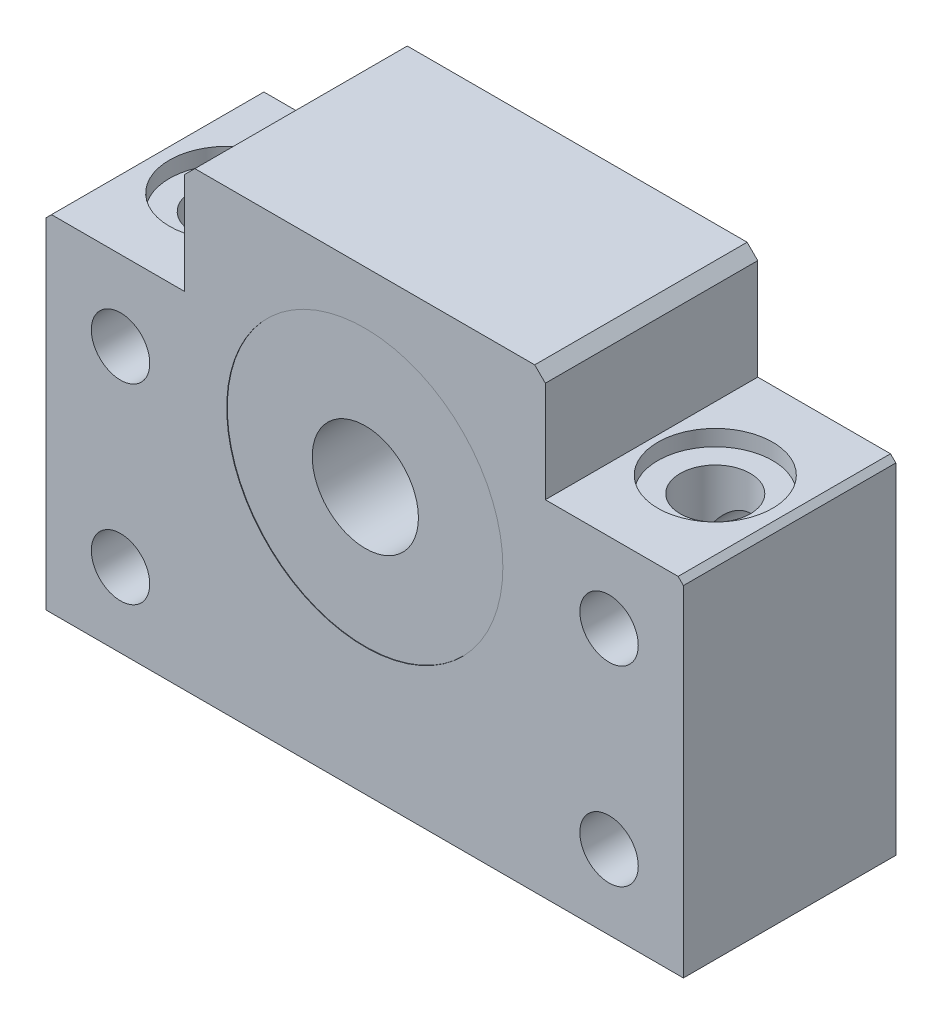
from build123d import *

# Parameters (mm, degrees)
EXTRUDE_1_DEPTH      = 10
EXTRUDE_1_DEPTH_BACK = 10
SKETCH_1_R           = 2.75
SKETCH_1_R_2         = 13
CUT_EXTRUDE_START    = 7.5
SKETCH_2_R           = 3.3
CUT_EXTRUDE_1_DEPTH  = 48.811288741
SKETCH_3_R           = 5.4
CUT_EXTRUDE_2_DEPTH  = 1.5
EXTRUDE_2_DEPTH      = 4
EXTRUDE_2_DEPTH_BACK = 4
EXTRUDE_2_START      = 5.95
SKETCH_4_R           = 13
SKETCH_4_R_2         = 5


with BuildPart() as part:
    # Эскиз1 → Бобышка-Вытянуть1 (new, two sides: drawn at the far end of the back side and taken through both)
    with BuildSketch(Plane.XY.offset(-EXTRUDE_1_DEPTH_BACK)):
        Polygon((-30, -25), (-30, 7), (-29.5, 7.5), (-17, 7.5), (-17, 17), (-16, 18), (16, 18), (17, 17), (17, 7.5), (29.5, 7.5), (30, 7), (30, -25), align=None)
        with Locations((-23, 0)):
            Circle(SKETCH_1_R, mode=Mode.SUBTRACT)
        with Locations((-23, -18)):
            Circle(SKETCH_1_R, mode=Mode.SUBTRACT)
        with Locations(Location((23, -18, 0), (0, 0, 180))):
            Circle(SKETCH_1_R, mode=Mode.SUBTRACT)
        with Locations(Location((23, 0, 0), (0, 0, 180))):
            Circle(SKETCH_1_R, mode=Mode.SUBTRACT)
        Circle(SKETCH_1_R_2, mode=Mode.SUBTRACT)
    extrude(amount=EXTRUDE_1_DEPTH + EXTRUDE_1_DEPTH_BACK)

    # Эскиз2 → Вырез-Вытянуть1 (cut, through all)
    with BuildSketch(Plane(origin=(0, 0, 0), x_dir=(1, 0, 0), z_dir=(0, 1, 0)).offset(CUT_EXTRUDE_START)):
        with Locations(Location((-23, 0, 0), (0, 0, 270))):
            Circle(SKETCH_2_R)
        with Locations(Location((23, 0, 0), (0, 0, 270))):
            Circle(SKETCH_2_R)
    extrude(amount=-CUT_EXTRUDE_1_DEPTH, mode=Mode.SUBTRACT)

    # Эскиз3 → Вырез-Вытянуть2 (cut)
    with BuildSketch(Plane(origin=(0, 0, 0), x_dir=(1, 0, 0), z_dir=(0, 1, 0)).offset(CUT_EXTRUDE_START)):
        with Locations(Location((-23, 0, 0), (0, 0, 270))):
            Circle(SKETCH_3_R)
        with Locations(Location((23, 0, 0), (0, 0, 270))):
            Circle(SKETCH_3_R)
    extrude(amount=-CUT_EXTRUDE_2_DEPTH, mode=Mode.SUBTRACT)

    # Эскиз4 → Бобышка-Вытянуть2 (add, two sides: drawn at the far end of the back side and taken through both)
    with BuildSketch(Plane.XY.offset(EXTRUDE_2_START - EXTRUDE_2_DEPTH_BACK)):
        Circle(SKETCH_4_R)
        Circle(SKETCH_4_R_2, mode=Mode.SUBTRACT)
    extrude(amount=EXTRUDE_2_DEPTH + EXTRUDE_2_DEPTH_BACK)


solid = part.part
